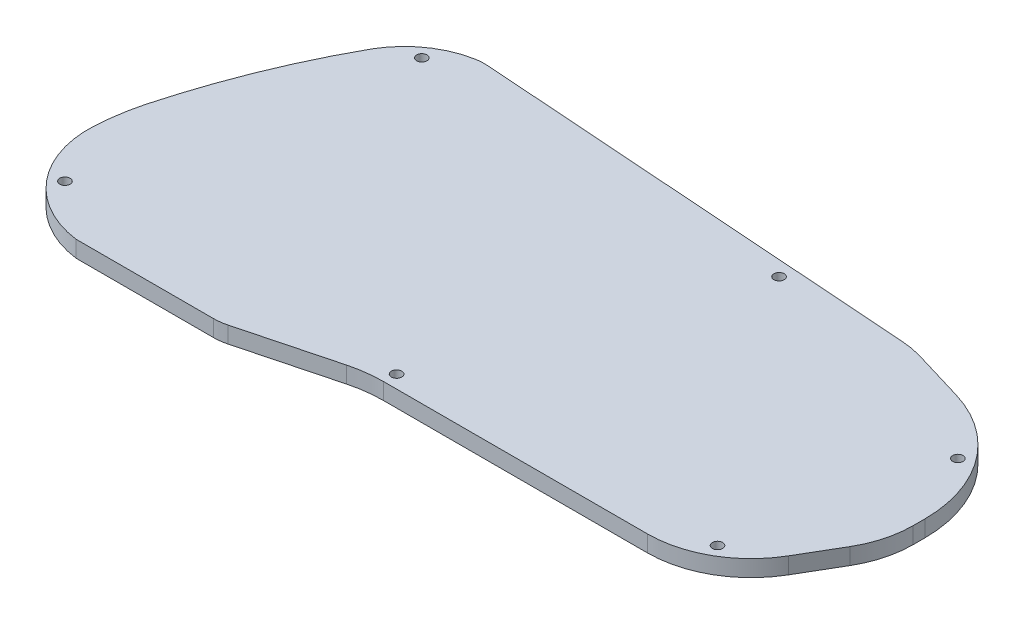
from build123d import *

# Parameters (mm, degrees)
SKETCH2_R           = 1
BOSS_EXTRUDE1_DEPTH = 3.175


with BuildPart() as part:
    # Sketch2 → Boss-Extrude1 (new body)
    with BuildSketch(Plane(origin=(0, 0, 0), x_dir=(1, 0, 0), z_dir=(0, 1, 0))):
        with BuildLine():
            Line((-179.386599243, -46.577112428), (-152.973973641, -46.577112428))
            ThreePointArc((-152.973973641, -46.577112428), (-151.696632976, -46.495196962), (-150.440219102, -46.250792593))
            Line((-150.440219102, -46.250792593), (-132.369306257, -41.517613837))
            ThreePointArc((-132.369306257, -41.517613837), (-129.228271572, -40.906602915), (-126.03491991, -40.70181425))
            Line((-126.03491991, -40.70181425), (-75.228071606, -40.70181425))
            ThreePointArc((-75.228071606, -40.70181425), (-65.278674057, -38.051439272), (-57.966239939, -30.802763092))
            Line((-57.966239939, -30.802763092), (-53.58197864, -23.310359981))
            ThreePointArc((-53.58197864, -23.310359981), (-51.642560943, -18.685572059), (-50.980718724, -13.714458582))
            Line((-50.980718724, -13.714458582), (-50.980718724, -11.480720615))
            ThreePointArc((-50.980718724, -11.480720615), (-55.872159917, 3.284056393), (-68.611443065, 12.207928979))
            Line((-68.611443065, 12.207928979), (-77.287357217, 14.807803777))
            add(Edge.make_bspline(
                [(-77.287357217, 14.807803777), (-78.60290824, 15.260617984), (-80.496334385, 15.662389675), (-81.330596094, 15.796728052), (-81.912447463, 15.872382986), (-82.202137874, 15.903094978), (-82.558274171, 15.939367788), (-82.869941903, 15.961449205)],
                knots=[0.680418275, 0.680418275, 0.680418275, 0.836668275, 0.899168275, 0.935139496, 0.961668275, 0.966389496, 1, 1, 1], degree=2))
            Line((-82.869941903, 15.961449205), (-168.585599211, 22.03433695))
            ThreePointArc((-168.585599211, 22.03433695), (-169.908476001, 22.040340453), (-171.220569819, 21.871672567))
            ThreePointArc((-171.220569819, 21.871672567), (-177.816509337, 19.029235729), (-182.649967908, 13.716652219))
            add(Edge.make_bspline(
                [(-182.649967908, 13.716652219), (-184.020157032, 11.266604381), (-186.59553254, 6.270980952), (-189.973739026, -1.442317999), (-192.87751868, -9.367305357), (-194.495666875, -14.743968327), (-195.233463462, -17.45250711)],
                knots=[0.255798806, 0.255798806, 0.255798806, 0.255798806, 0.412929873, 0.570060941, 0.727192008, 0.884323076, 0.884323076, 0.884323076, 0.884323076], degree=3))
            ThreePointArc((-195.233463462, -17.45250711), (-196.09568693, -21.651142502), (-196.548238057, -25.913438355))
            ThreePointArc((-196.548238057, -25.913438355), (-192.037135811, -39.625265598), (-179.386599243, -46.577112428))
        make_face()
        with Locations(Location((-66.522348751, -35.882736145, 0), (0, 0, 270))):
            Circle(SKETCH2_R, mode=Mode.SUBTRACT)
        with Locations(Location((-57.877663419, 1.791422578, 0), (0, 0, 270))):
            Circle(SKETCH2_R, mode=Mode.SUBTRACT)
        with Locations(Location((-105.433568659, 14.889534132, 0), (0, 0, 270))):
            Circle(SKETCH2_R, mode=Mode.SUBTRACT)
        with Locations(Location((-176.36445576, 16.994158234, 0), (0, 0, 270))):
            Circle(SKETCH2_R, mode=Mode.SUBTRACT)
        with Locations(Location((-190.160816791, -37.970957718, 0), (0, 0, 270))):
            Circle(SKETCH2_R, mode=Mode.SUBTRACT)
        with Locations(Location((-126.03491991, -38.20181425, 0), (0, 0, 270))):
            Circle(SKETCH2_R, mode=Mode.SUBTRACT)
    extrude(amount=BOSS_EXTRUDE1_DEPTH)


solid = part.part
